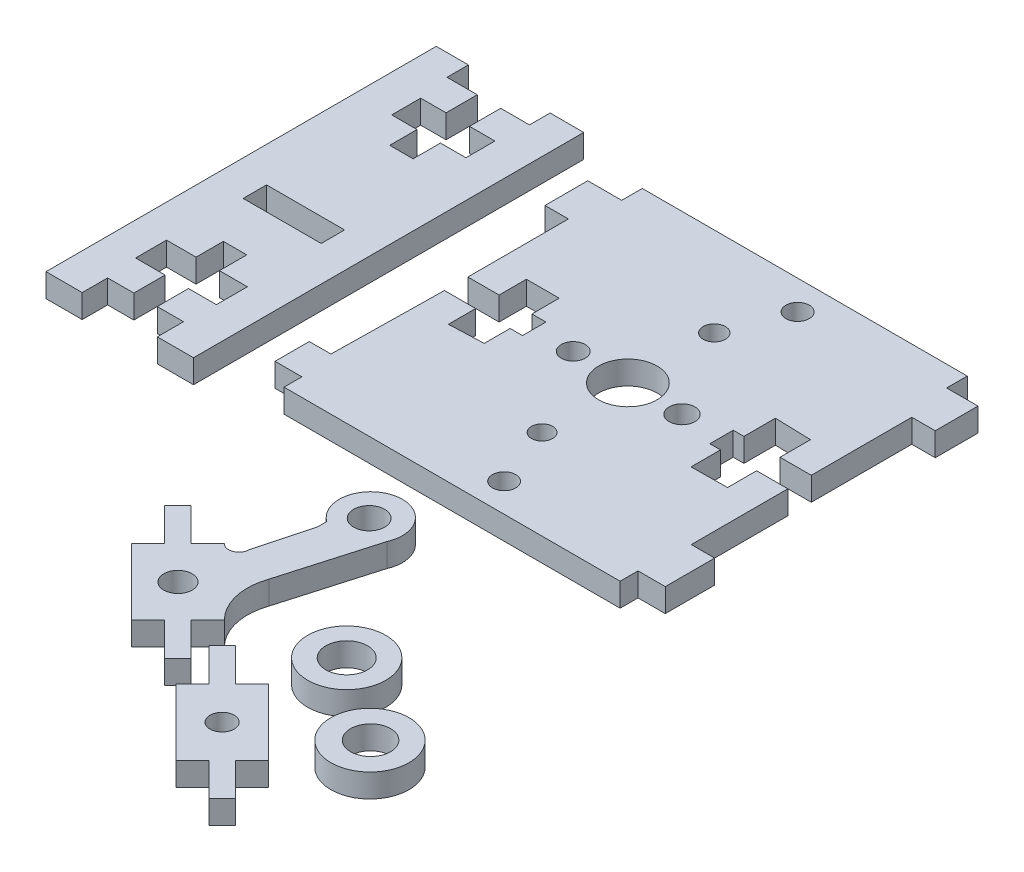
from build123d import *

# Parameters (mm, degrees)
SKETCH6_R             = 5.00001662
SKETCH6_R_2           = 2.676301768
BOSS_EXTRUDE1_DEPTH   = 3
SKETCH6_R_3           = 5.003976988
SKETCH6_R_4           = 2.564352457
BOSS_EXTRUDE1_2_DEPTH = 3
SKETCH6_R_5           = 3.75
SKETCH6_R_6           = 1.53326
SKETCH6_R_7           = 1.42391285
SKETCH6_R_8           = 1.648176726
SKETCH6_R_9           = 1.5
SKETCH6_R_10          = 1.352434515
SKETCH6_R_11          = 1.489057141
BOSS_EXTRUDE1_3_DEPTH = 3
SKETCH6_W             = 10
SKETCH6_H             = 3
BOSS_EXTRUDE1_4_DEPTH = 3
SKETCH6_R_12          = 1.987556524
SKETCH6_R_13          = 1.820084062
BOSS_EXTRUDE1_5_DEPTH = 3
SKETCH6_R_14          = 1.549963263
BOSS_EXTRUDE1_6_DEPTH = 3


with BuildPart() as part:
    # Sketch6 → Boss-Extrude1 (new body)
    with BuildSketch(Plane(origin=(0, 0, -6.873626876), x_dir=(1, 0, 0), z_dir=(0, 1, 0))):
        with Locations(Location((229.874784709, -56.056944562, 0), (0, 0, 270))):
            Circle(SKETCH6_R)
        with Locations(Location((229.874784709, -56.056944562, 0), (0, 0, 270))):
            Circle(SKETCH6_R_2, mode=Mode.SUBTRACT)
    extrude(amount=BOSS_EXTRUDE1_DEPTH)


with BuildPart() as body_2:
    # Sketch6 → Boss-Extrude1 2 (new body)
    with BuildSketch(Plane(origin=(0, 0, -6.873626876), x_dir=(1, 0, 0), z_dir=(0, 1, 0))):
        with Locations(Location((240.501206391, -63.709072507, 0), (0, 0, 270))):
            Circle(SKETCH6_R_3)
        with Locations(Location((240.542284709, -63.667989562, 0), (0, 0, 270))):
            Circle(SKETCH6_R_4, mode=Mode.SUBTRACT)
    extrude(amount=BOSS_EXTRUDE1_2_DEPTH)


with BuildPart() as body_3:
    # Sketch6 → Boss-Extrude1 3 (new body)
    with BuildSketch(Plane(origin=(0, 0, -6.873626876), x_dir=(1, 0, 0), z_dir=(0, 1, 0))):
        Polygon((242.382239794, 6.836701249), (239.382239794, 6.836701249), (239.382239794, -6.042586825), (235.382239794, -6.042586825), (235.382239794, -2.14531779), (230.749800061, -2.004695449), (230.749800061, -6.042586825), (229.382239794, -6.042586825), (229.382239794, -9.042586825), (230.748691654, -9.042586825), (230.748691654, -12.813516805), (235.382239794, -12.767263811), (235.382239794, -9.042586825), (239.382239794, -9.042586825), (239.382239794, -21.421316018), (242.382239794, -21.421316018), (242.382239794, -27.751611143), (238.890190267, -27.751611143), (238.890190267, -30.042586825), (195.823762638, -30.042586825), (195.823762638, -27.751611143), (192.382239794, -27.751611143), (192.382239794, -23.361733729), (195.157204069, -23.361733729), (195.382239794, -9.042586825), (199.382239794, -9.042586825), (199.382239794, -12.539051999), (203.797700047, -12.360940289), (203.797700047, -9.042586825), (205.382239794, -9.042586825), (205.382239794, -6.042586825), (203.587068887, -6.042586825), (203.587068887, -2.54340954), (199.382239794, -2.54340954), (199.382239794, -6.042586825), (195.382239794, -6.042586825), (195.382239794, 6.836593447), (192.382239794, 6.836593447), (192.382239794, 12.317708836), (196.731116236, 12.317708836), (196.731116236, 14.957413175), (238.366254708, 14.957413175), (238.366254708, 12.317708836), (242.382239794, 12.317708836), align=None)
        with Locations(Location((217.382239794, -7.542579319, 0), (0, 0, 270))):
            Circle(SKETCH6_R_5, mode=Mode.SUBTRACT)
        with Locations(Location((210.382239794, -7.542586825, 0), (0, 0, 270))):
            Circle(SKETCH6_R_6, mode=Mode.SUBTRACT)
        with Locations(Location((217.372614794, 3.539788175, 0), (0, 0, 270))):
            Circle(SKETCH6_R_7, mode=Mode.SUBTRACT)
        with Locations(Location((224.332886765, -7.554518996, 0), (0, 0, 270))):
            Circle(SKETCH6_R_8, mode=Mode.SUBTRACT)
        with Locations(Location((220.382239794, 11.207413175, 0), (0, 0, 270))):
            Circle(SKETCH6_R_9, mode=Mode.SUBTRACT)
        with Locations(Location((217.382239794, -18.536664507, 0), (0, 0, 270))):
            Circle(SKETCH6_R_10, mode=Mode.SUBTRACT)
        with Locations(Location((220.368609085, -26.382015564, 0), (0, 0, 270))):
            Circle(SKETCH6_R_11, mode=Mode.SUBTRACT)
    extrude(amount=BOSS_EXTRUDE1_3_DEPTH)


with BuildPart() as body_4:
    # Sketch6 → Boss-Extrude1 4 (new body)
    with BuildSketch(Plane(origin=(0, 0, -6.873626876), x_dir=(1, 0, 0), z_dir=(0, 1, 0))):
        Polygon((171.883428579, 17.523976804), (171.883428579, 14.779888825), (175.763491707, 14.779888825), (175.763491707, 10.779888825), (172.516185966, 10.779888825), (172.516185966, 7.062992514), (175.763491707, 7.062992514), (175.763491707, 3.562992514), (178.763491707, 3.562992514), (178.763491707, 7.062992514), (182.028068614, 7.062992514), (182.028068614, 10.779888825), (178.763491707, 10.779888825), (178.763491707, 14.779888825), (182.452460556, 14.779888825), (182.452460556, 17.421571169), (186.763491707, 17.421571169), (186.763491707, -32.578428831), (182.127695455, -32.578428831), (182.127695455, -29.220111175), (178.763491707, -29.220111175), (178.763491707, -25.220111175), (182.34039673, -25.220111175), (182.34039673, -21.252563381), (178.763491707, -21.252563381), (178.763491707, -17.752563381), (175.763491707, -17.752563381), (175.763491707, -21.252563381), (171.982778318, -21.252563381), (171.982778318, -25.220111175), (175.763491707, -25.220111175), (175.763491707, -29.220111175), (172.40417104, -29.220111175), (172.40417104, -32.476023196), (167.763491707, -32.476023196), (167.763491707, 17.523976804), align=None)
        with Locations((177.263491707, -10.220111175)):
            Rectangle(SKETCH6_W, SKETCH6_H, mode=Mode.SUBTRACT)
    extrude(amount=BOSS_EXTRUDE1_4_DEPTH)


with BuildPart() as body_5:
    # Sketch6 → Boss-Extrude1 5 (new body)
    with BuildSketch(Plane(origin=(0, 0, -6.873626876), x_dir=(1, 0, 0), z_dir=(0, 1, 0))):
        with BuildLine():
            Line((217.860134709, -59.724119562), (215.738834709, -61.845439562))
            Line((215.738834709, -61.845439562), (219.981434709, -66.088079562))
            Line((219.981434709, -66.088079562), (218.284434709, -67.785139562))
            Line((218.284434709, -67.785139562), (214.041739708, -63.542484562))
            Line((214.041739708, -63.542484562), (211.920434709, -65.663809562))
            Line((211.920434709, -65.663809562), (203.435134709, -57.178529562))
            Line((203.435134709, -57.178529562), (205.556434709, -55.057209562))
            Line((205.556434709, -55.057209562), (201.313834709, -50.814569562))
            Line((201.313834709, -50.814569562), (203.010934709, -49.117519562))
            Line((203.010934709, -49.117519562), (207.253534709, -53.360159562))
            Line((207.253534709, -53.360159562), (209.374834709, -51.238839562))
            ThreePointArc((209.374834709, -51.238839562), (210.816400769, -51.525579581), (211.632980333, -50.303478783))
            Line((211.632980333, -50.303478783), (213.474534709, -43.456719562))
            Line((213.474534709, -43.456719562), (213.474534709, -42.219932453))
            ThreePointArc((213.474534709, -42.219932453), (214.794826347, -35.039859898), (219.548340876, -40.580682177))
            Line((219.548340876, -40.580682177), (216.163084709, -52.299499562))
            ThreePointArc((216.163084709, -52.299499562), (215.942727144, -56.256124713), (217.860134709, -59.724119562))
        make_face()
        with Locations(Location((215.824034709, -39.132809562, 0), (0, 0, 270))):
            Circle(SKETCH6_R_12, mode=Mode.SUBTRACT)
        with Locations(Location((210.647634709, -58.451324562, 0), (0, 0, 270))):
            Circle(SKETCH6_R_13, mode=Mode.SUBTRACT)
    extrude(amount=BOSS_EXTRUDE1_5_DEPTH)


with BuildPart() as body_6:
    # Sketch6 → Boss-Extrude1 6 (new body)
    with BuildSketch(Plane(origin=(0, 0, -6.873626876), x_dir=(1, 0, 0), z_dir=(0, 1, 0))):
        Polygon((227.759629709, -63.966754562), (236.244954708, -72.452019563), (234.123654708, -74.573339563), (238.366254708, -78.815979563), (236.669154708, -80.513039563), (232.426554708, -76.270399563), (230.305254708, -78.391719563), (221.819934709, -69.906459562), (223.941234709, -67.785139562), (219.698634709, -63.542489562), (221.395634709, -61.845439562), (225.638334709, -66.088079562), align=None)
        with Locations(Location((229.032434709, -71.179244562, 0), (0, 0, 270))):
            Circle(SKETCH6_R_14, mode=Mode.SUBTRACT)
    extrude(amount=BOSS_EXTRUDE1_6_DEPTH)


solid = Compound([part.part, body_2.part, body_3.part, body_4.part, body_5.part, body_6.part])
